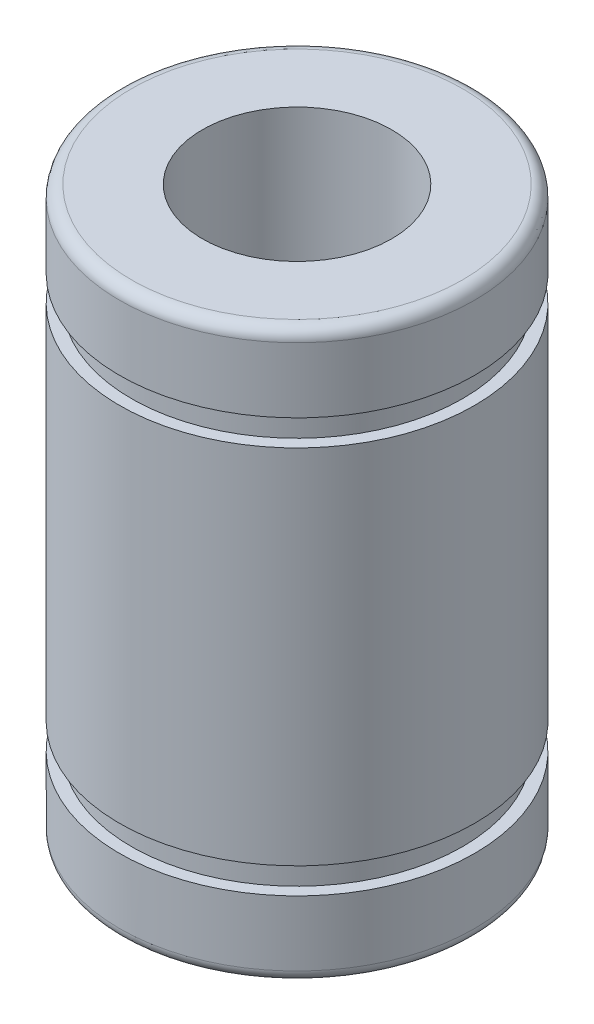
from build123d import *

# Parameters (mm, degrees)
FILLET1_R = 0.5


with BuildPart() as part:
    # Sketch1 → Revolve1 (revolve)
    with BuildSketch(Plane.XY, mode=Mode.PRIVATE) as revolve1_sk:
        Polygon((-4, 12), (-7.5, 12), (-7.5, 8.75), (-7, 8.75), (-7, 7.65), (-7.5, 7.65), (-7.5, -7.65), (-7, -7.65), (-7, -8.75), (-7.5, -8.75), (-7.5, -12), (-4, -12), align=None)
    revolve(revolve1_sk.sketch.rotate(Axis((0, 0, 0), (0, 1, 0)), 180), axis=Axis((0, 0, 0), (0, 1, 0)))

    # Fillet1
    fillet1_edges = [part.edges().sort_by_distance(p)[0] for p in [
        (-7.5, -12, 0),
        (-7.5, 12, 0),
    ]]
    fillet(fillet1_edges, radius=FILLET1_R)


solid = part.part
